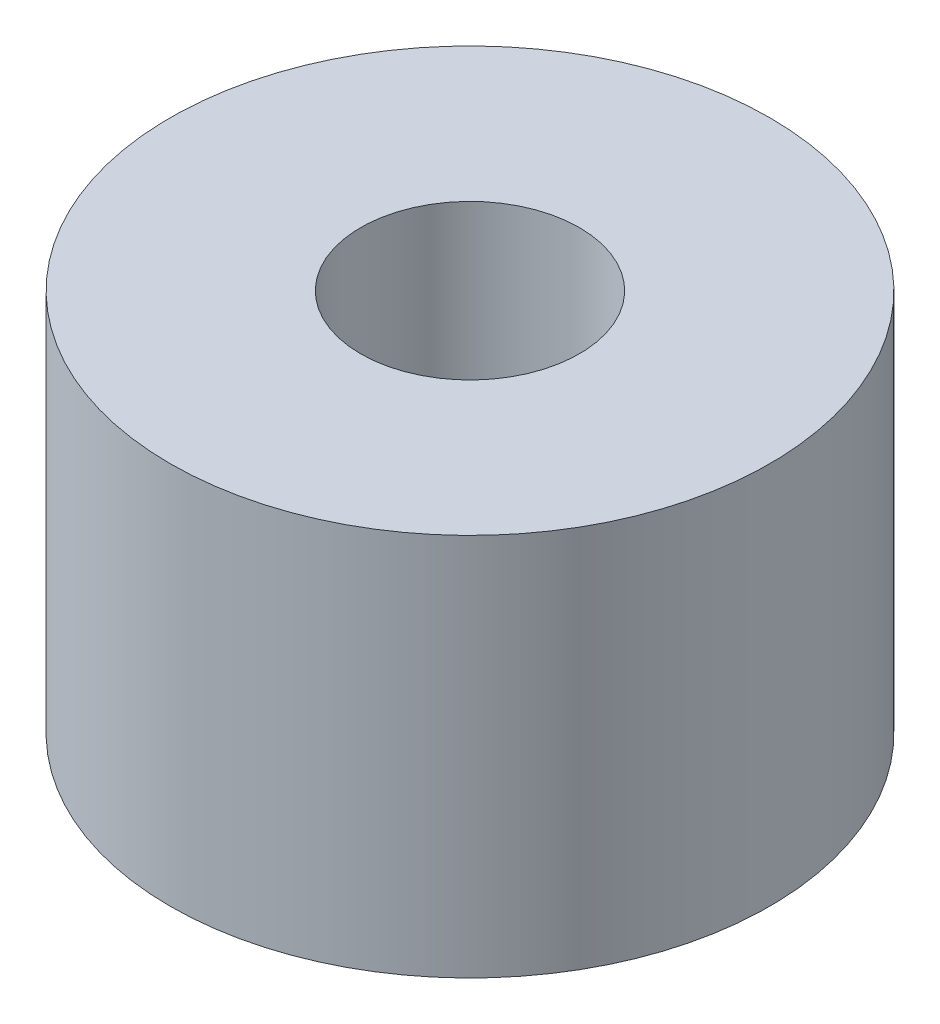
from build123d import *

# Parameters (mm, degrees)
SKETCH1_R           = 8.6995
SKETCH1_R_2         = 3.175
BOSS_EXTRUDE1_DEPTH = 11.1252


with BuildPart() as part:
    # Sketch1 → Boss-Extrude1 (new body)
    with BuildSketch(Plane(origin=(0, 0, 0), x_dir=(1, 0, 0), z_dir=(0, 1, 0))):
        with Locations(Location((0, 0, 0), (0, 0, 90))):
            Circle(SKETCH1_R)
        with Locations(Location((0, 0, 0), (0, 0, 90))):
            Circle(SKETCH1_R_2, mode=Mode.SUBTRACT)
    extrude(amount=BOSS_EXTRUDE1_DEPTH)


solid = part.part
